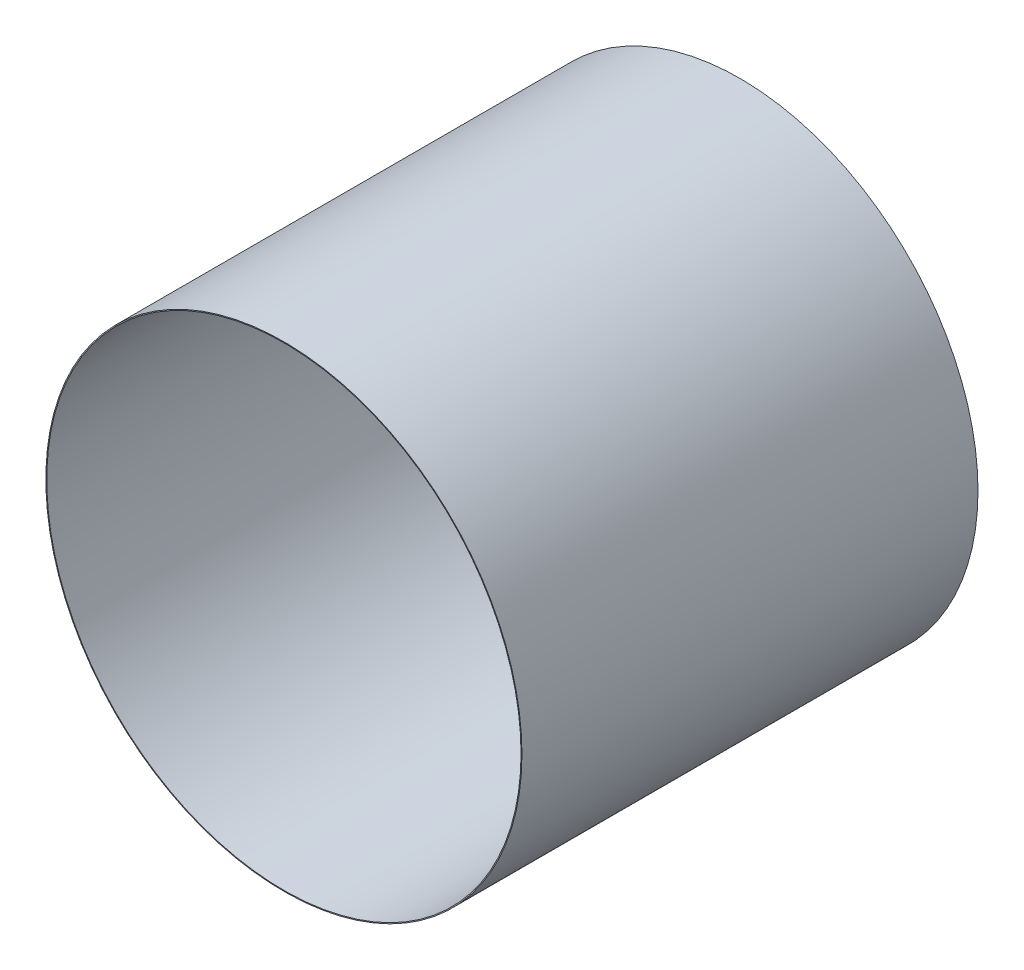
from build123d import *

# Parameters (mm, degrees)
SKETCH1_R           = 13.05
SKETCH1_R_2         = 13
BOSS_EXTRUDE1_DEPTH = 25


with BuildPart() as part:
    # Sketch1 → Boss-Extrude1 (new body)
    with BuildSketch(Plane.XY):
        Circle(SKETCH1_R)
        Circle(SKETCH1_R_2, mode=Mode.SUBTRACT)
    extrude(amount=BOSS_EXTRUDE1_DEPTH)


solid = part.part
